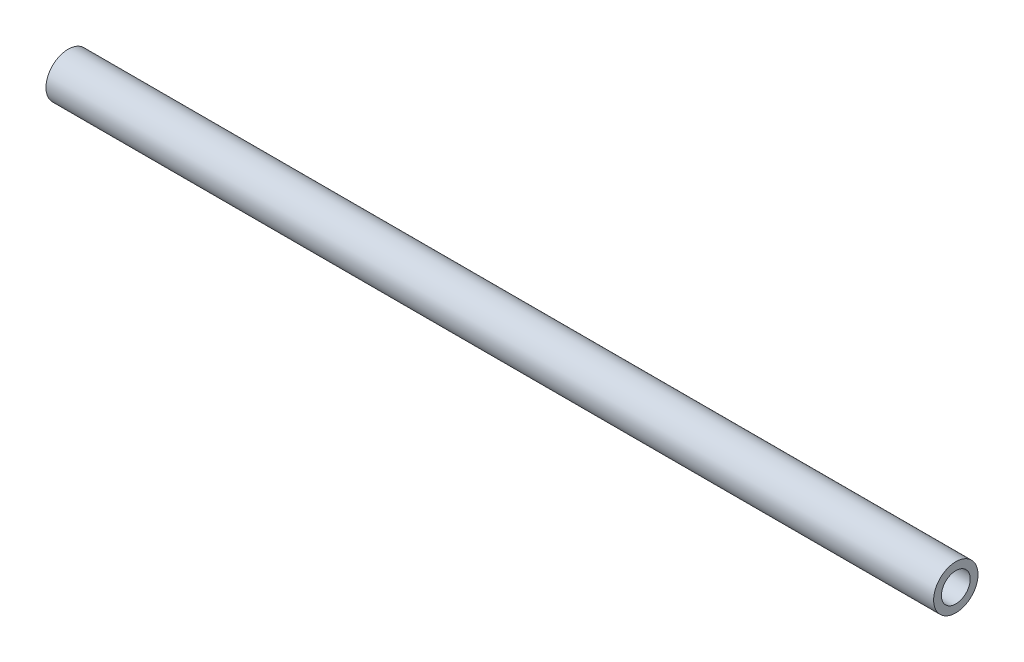
from build123d import *

# Parameters (mm, degrees)
SKETCH_1_R      = 10
SKETCH_1_R_2    = 6.5
EXTRUDE_1_DEPTH = 400


with BuildPart() as part:
    # Эскиз1 → Бобышка-Вытянуть1 (new body)
    with BuildSketch(Plane(origin=(0, 0, 0), x_dir=(0, 0, -1), z_dir=(1, 0, 0))):
        Circle(SKETCH_1_R)
        Circle(SKETCH_1_R_2, mode=Mode.SUBTRACT)
    extrude(amount=EXTRUDE_1_DEPTH)


solid = part.part
